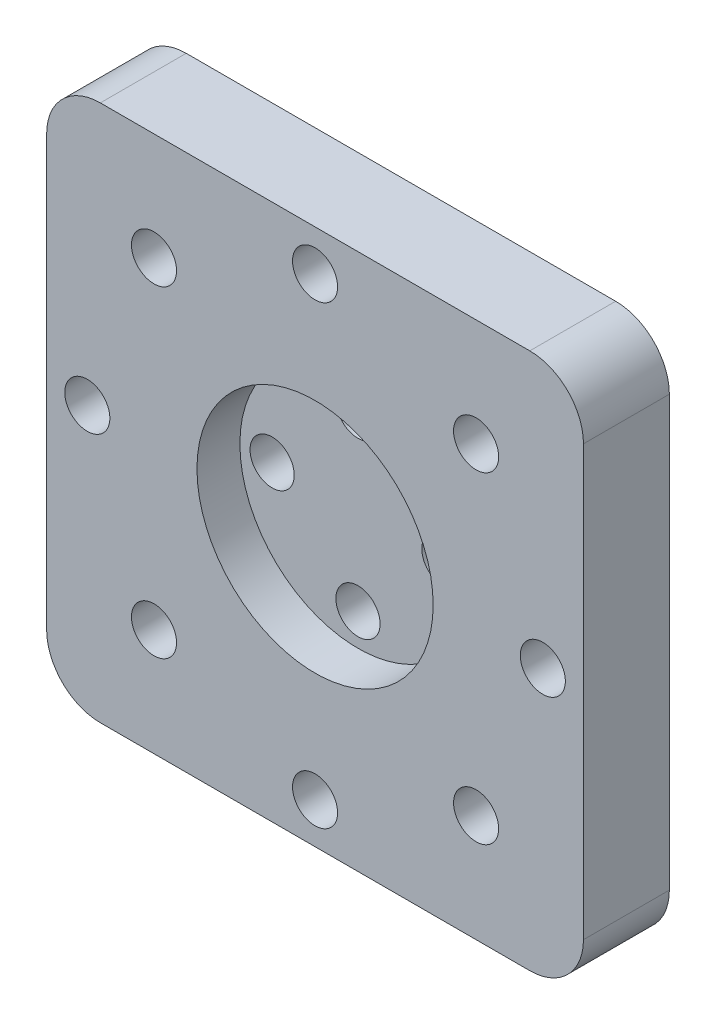
from build123d import *

# Parameters (mm, degrees)
SKETCH_1_R          = 14.149308539
SKETCH_1_R_2        = 2.058081242
EXTRUDE_1_DEPTH     = 8
SKETCH_2_R          = 2.1
CUT_EXTRUDE_1_DEPTH = 37.249137921
SKETCH_3_R          = 11
CUT_EXTRUDE_2_DEPTH = 4


with BuildPart() as part:
    # 草图1 → 凸台-拉伸1 (new body)
    # profile 1 of 2: a face of its own
    with BuildSketch(Plane.XY):
        with BuildLine():
            ThreePointArc((20, 25), (23.535533906, 23.535533906), (25, 20))
            Line((25, 20), (25, -20))
            ThreePointArc((25, -20), (23.535533906, -23.535533906), (20, -25))
            Line((20, -25), (-20, -25))
            ThreePointArc((-20, -25), (-23.535533906, -23.535533906), (-25, -20))
            Line((-25, -20), (-25, 20))
            ThreePointArc((-25, 20), (-23.535533906, 23.535533906), (-20, 25))
            Line((-20, 25), (20, 25))
        make_face()
        Circle(SKETCH_1_R, mode=Mode.SUBTRACT)
    # profile 2 of 2: a face of its own
    with BuildSketch(Plane.XY):
        Circle(SKETCH_1_R)
        with Locations((-8, 0)):
            Circle(SKETCH_1_R_2, mode=Mode.SUBTRACT)
        with Locations((0, -8)):
            Circle(SKETCH_1_R_2, mode=Mode.SUBTRACT)
        with Locations((8, 0)):
            Circle(SKETCH_1_R_2, mode=Mode.SUBTRACT)
        with Locations((0, 8)):
            Circle(SKETCH_1_R_2, mode=Mode.SUBTRACT)
    extrude(amount=EXTRUDE_1_DEPTH)

    # 草图2 → 切除-拉伸1 (cut, through all)
    with BuildSketch(Plane.XY.offset(8)):
        with Locations((-15, 15)):
            Circle(SKETCH_2_R)
        with Locations(Location((-15, -15, 0), (0, 0, 180))):
            Circle(SKETCH_2_R)
        with Locations((15, -15)):
            Circle(SKETCH_2_R)
        with Locations(Location((15, 15, 0), (0, 0, 180))):
            Circle(SKETCH_2_R)
        with Locations(Location((21.213203436, 0, 0), (0, 0, 180))):
            Circle(SKETCH_2_R)
        with Locations((0, 21.213203436)):
            Circle(SKETCH_2_R)
        with Locations(Location((-21.213203436, 0, 0), (0, 0, 180))):
            Circle(SKETCH_2_R)
        with Locations((0, -21.213203436)):
            Circle(SKETCH_2_R)
    extrude(amount=-CUT_EXTRUDE_1_DEPTH, mode=Mode.SUBTRACT)

    # 草图3 → 切除-拉伸2 (cut)
    with BuildSketch(Plane.XY.offset(8)):
        Circle(SKETCH_3_R)
    extrude(amount=-CUT_EXTRUDE_2_DEPTH, mode=Mode.SUBTRACT)


solid = part.part
